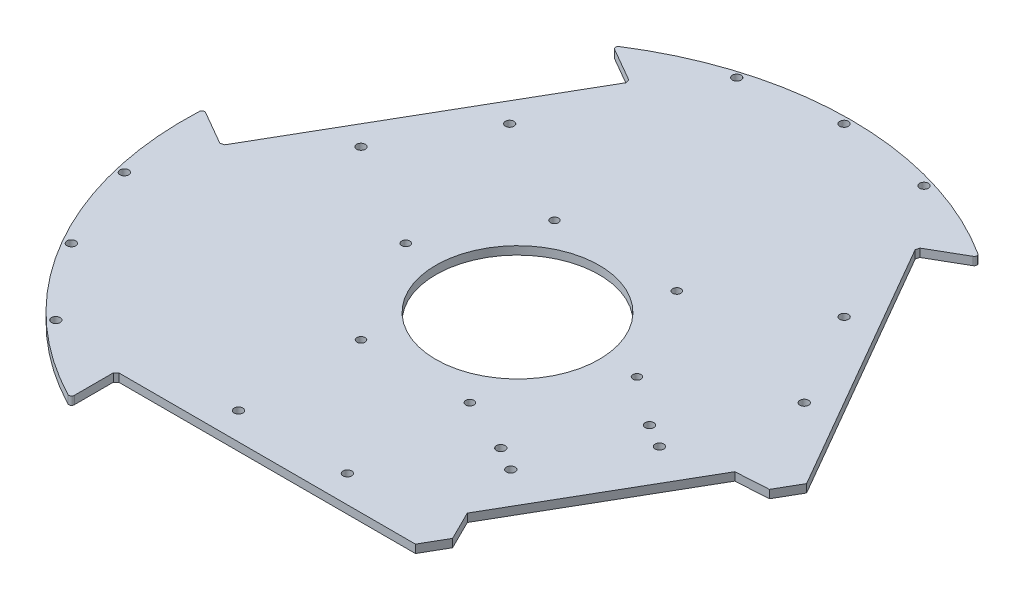
from build123d import *

# Parameters (mm, degrees)
SKETCH_1_R          = 122.5
EXTRUDE_1_DEPTH     = 3
SKETCH_2_R          = 1.6
SKETCH_2_R_2        = 30
SKETCH_2_R_3        = 1.5
CUT_EXTRUDE_1_DEPTH = 174.267134795
CHAMFER_1_SIZE      = 1
FILLET_1_R          = 1


with BuildPart() as part:
    # ｽｹｯﾁ1 → ﾎﾞｽ - 押し出し1 (new body)
    with BuildSketch(Plane(origin=(0, 0, 0), x_dir=(1, 0, 0), z_dir=(0, 1, 0))):
        with Locations(Location((0, 0, 0), (0, 0, 270))):
            Circle(SKETCH_1_R)
    extrude(amount=EXTRUDE_1_DEPTH)

    # ｽｹｯﾁ2 → ｶｯﾄ - 押し出し1 (cut, through all)
    with BuildSketch(Plane(origin=(0, 3, 0), x_dir=(1, 0, 0), z_dir=(0, 1, 0))):
        with Locations(Location((20, -82.5, 0), (0, 0, 270))):
            Circle(SKETCH_2_R)
        with Locations(Location((-20, -82.5, 0), (0, 0, 270))):
            Circle(SKETCH_2_R)
        with Locations(Location((81.447095812, 23.929491924, 0), (0, 0, 270))):
            Circle(SKETCH_2_R)
        with Locations(Location((61.447095812, 58.570508076, 0), (0, 0, 270))):
            Circle(SKETCH_2_R)
        with Locations(Location((-61.447095812, 58.570508076, 0), (0, 0, 270))):
            Circle(SKETCH_2_R)
        with Locations(Location((-81.447095812, 23.929491924, 0), (0, 0, 270))):
            Circle(SKETCH_2_R)
        with Locations(Location((0, 0, 0), (0, 0, 270))):
            Circle(SKETCH_2_R_2)
        with Locations(Location((-42.475952642, 1.429491924, 0), (0, 0, 270))):
            Circle(SKETCH_2_R_3)
        with Locations(Location((-22.475952642, 36.070508076, 0), (0, 0, 270))):
            Circle(SKETCH_2_R_3)
        with Locations(Location((22.475952642, 36.070508076, 0), (0, 0, 270))):
            Circle(SKETCH_2_R_3)
        with Locations(Location((42.475952642, 1.429491924, 0), (0, 0, 270))):
            Circle(SKETCH_2_R_3)
        with Locations(Location((20, -37.5, 0), (0, 0, 270))):
            Circle(SKETCH_2_R_3)
        with Locations(Location((-20, -37.5, 0), (0, 0, 270))):
            Circle(SKETCH_2_R_3)
        with Locations(Location((-116.76259025, -27.685691575, 0), (0, 0, 270))):
            Circle(SKETCH_2_R)
        with Locations(Location((-103.923048454, -60, 0), (0, 0, 270))):
            Circle(SKETCH_2_R)
        with Locations(Location((-82.357807351, -87.276523581, 0), (0, 0, 270))):
            Circle(SKETCH_2_R)
        with Locations(Location((0, 120, 0), (0, 0, 270))):
            Circle(SKETCH_2_R)
        with Locations(Location((-34.4047829, 114.962215156, 0), (0, 0, 270))):
            Circle(SKETCH_2_R)
        with Locations(Location((34.4047829, 114.962215156, 0), (0, 0, 270))):
            Circle(SKETCH_2_R)
        with Locations(Location((48.787014427, -51.26120668, 0), (0, 0, 270))):
            Circle(SKETCH_2_R)
        with Locations(Location((68.787014427, -16.620190528, 0), (0, 0, 270))):
            Circle(SKETCH_2_R)
        with Locations(Location((40.126760389, -46.26120668, 0), (0, 0, 270))):
            Circle(SKETCH_2_R)
        with Locations(Location((60.126760389, -11.620190528, 0), (0, 0, 270))):
            Circle(SKETCH_2_R)
        Polygon((-55, -92.5), (55, -92.5), (60, -83.839745962), (54.656370753, -73.095183316), (90.630471022, -10.786213893), (102.60734985, -10.041651246), (107.60734985, -1.381397208), (52.60734985, 93.881397208), (104.568874077, 123.881397208), (159.568874077, 28.618602792), (55, -152.5), (-55, -152.5), align=None)
        Polygon((-104.568874077, 123.881397208), (-159.568874077, 28.618602792), (-107.60734985, -1.381397208), (-52.60734985, 93.881397208), align=None)
    extrude(amount=-CUT_EXTRUDE_1_DEPTH, mode=Mode.SUBTRACT)

    # 面取り1
    chamfer_1_edges = [part.edges().sort_by_distance(p)[0] for p in [
        (52.60734985, 1.5, -93.881397208),
        (-55, 1.5, 92.5),
        (-107.60734985, 1.5, 1.381397208),
        (-52.60734985, 1.5, -93.881397208),
    ]]
    chamfer(chamfer_1_edges, length=CHAMFER_1_SIZE)

    # ﾌｨﾚｯﾄ1
    fillet_1_edges = [part.edges().sort_by_distance(p)[0] for p in [
        (-55, 1.5, 109.458896395),
        (67.294184948, 1.5, -102.360845406),
        (-67.294184948, 1.5, -102.360845406),
        (-122.294184948, 1.5, -7.098050989),
    ]]
    fillet(fillet_1_edges, radius=FILLET_1_R)


solid = part.part
